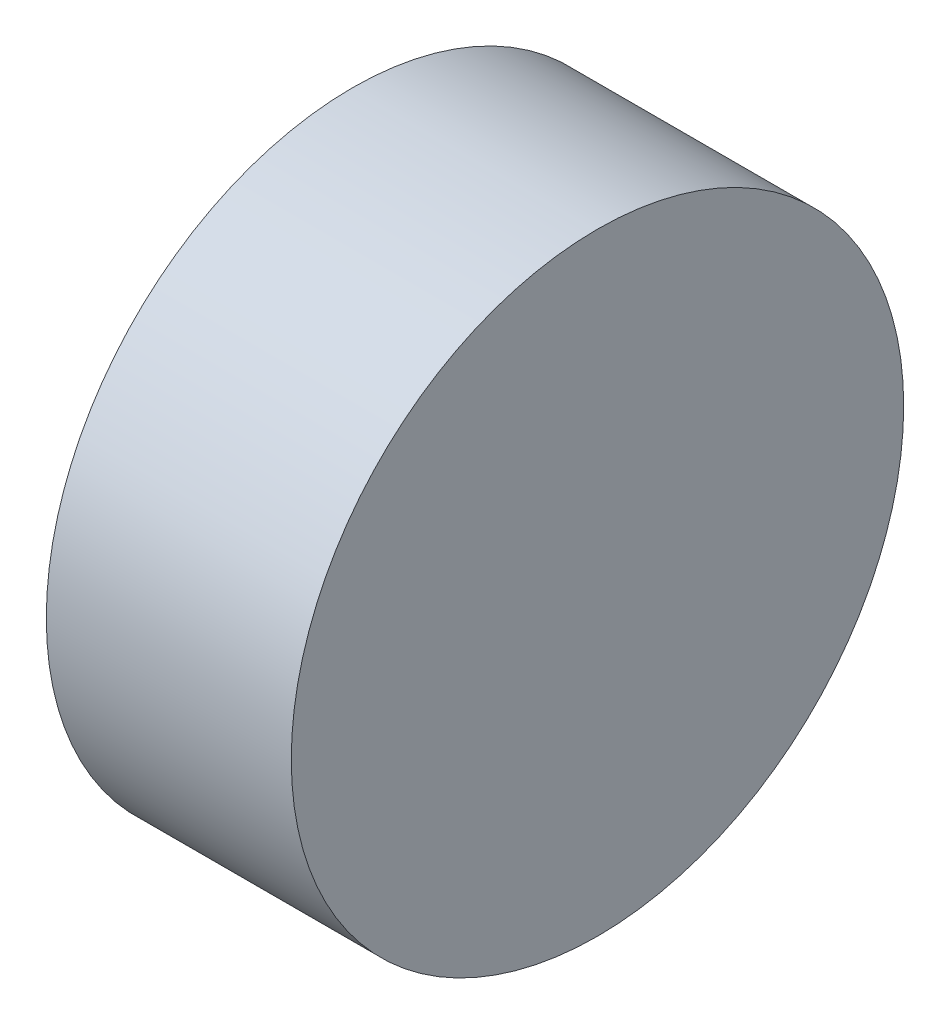
from build123d import *

# Parameters (mm, degrees)
BOSS_EXTRUDE1_DEPTH      = 1000
BOSS_EXTRUDE1_DEPTH_BACK = 1000
SKETCH1_R                = 2500


with BuildPart() as part:
    # Sketch1 → Boss-Extrude1 (new, two sides: drawn at the far end of the back side and taken through both)
    with BuildSketch(Plane(origin=(0, 0, 0), x_dir=(0, 0, -1), z_dir=(1, 0, 0)).offset(-BOSS_EXTRUDE1_DEPTH_BACK)):
        with Locations((0, -2480)):
            Circle(SKETCH1_R)
    extrude(amount=BOSS_EXTRUDE1_DEPTH + BOSS_EXTRUDE1_DEPTH_BACK)


solid = part.part
